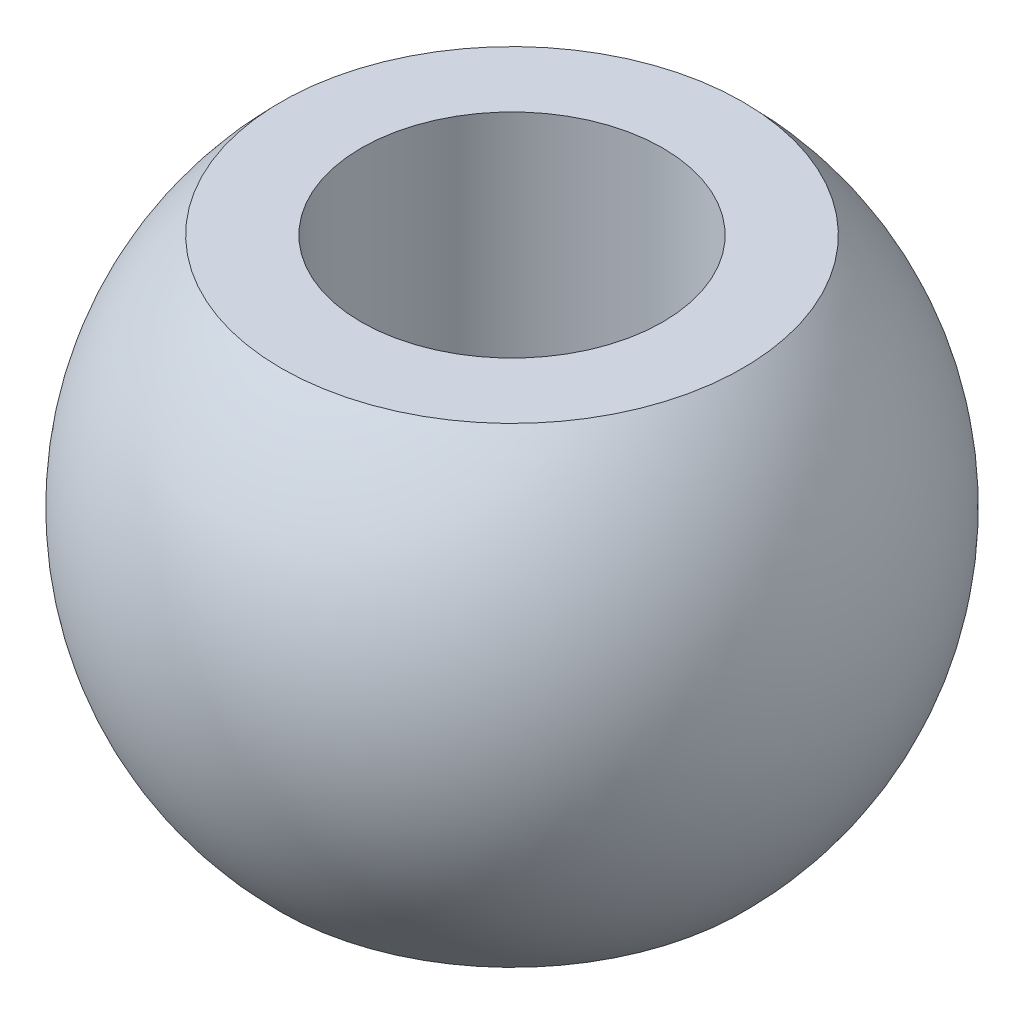
from build123d import *

# Parameters (mm, degrees)
M3_CLEARANCE_HOLE1_D     = 3.2
M3_CLEARANCE_HOLE1_DEPTH = 7.5
M3_CLEARANCE_HOLE1_TIP   = 0.96137699


with BuildPart() as part:
    # Sketch1 → Revolve1 (revolve)
    with BuildSketch(Plane(origin=(0, 0, 0), x_dir=(0, 0, -1), z_dir=(1, 0, 0))):
        with BuildLine():
            Line((0, 2.5), (0, -2.5))
            Line((0, -2.5), (2.449489743, -2.5))
            ThreePointArc((2.449489743, -2.5), (3.5, 0), (2.449489743, 2.5))
            Line((2.449489743, 2.5), (0, 2.5))
        make_face()
    revolve(axis=Axis((0, 2.5, 0), (0, -1, 0)))

    # M3 Clearance Hole1
    with Locations(Plane.ZX.offset(3.5)):
        with Locations((0, 0)):
            Hole(M3_CLEARANCE_HOLE1_D / 2, depth=M3_CLEARANCE_HOLE1_DEPTH)
            with Locations((0, 0, -(M3_CLEARANCE_HOLE1_DEPTH + M3_CLEARANCE_HOLE1_TIP / 2))):  # 118° drill point
                Cone(0, M3_CLEARANCE_HOLE1_D / 2, M3_CLEARANCE_HOLE1_TIP, mode=Mode.SUBTRACT)


solid = part.part
